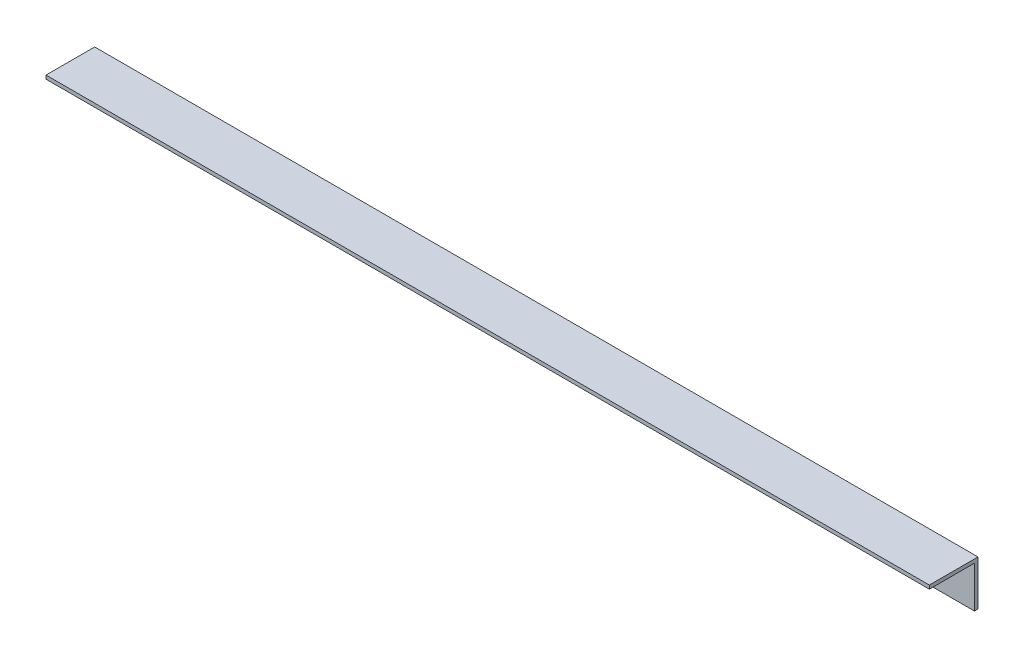
from build123d import *

# Parameters (mm, degrees)
SKETCH_1_W        = 1960
SKETCH_1_H        = 100
EXTRUDE_719_DEPTH = 8
SKETCH_2_W        = 1960
SKETCH_2_H        = 8
EXTRUDE_1_DEPTH   = 100


with BuildPart() as part:
    # 草图1 → Extrude 719 (new body)
    with BuildSketch(Plane.XY):
        with Locations((0, 44.512115183)):
            Rectangle(SKETCH_1_W, SKETCH_1_H)
    extrude(amount=EXTRUDE_719_DEPTH)

    # 草图2 → 凸台-拉伸1 (add)
    with BuildSketch(Plane.XY.offset(8)):
        with Locations((0, 90.512115183)):
            Rectangle(SKETCH_2_W, SKETCH_2_H)
    extrude(amount=EXTRUDE_1_DEPTH)


solid = part.part
